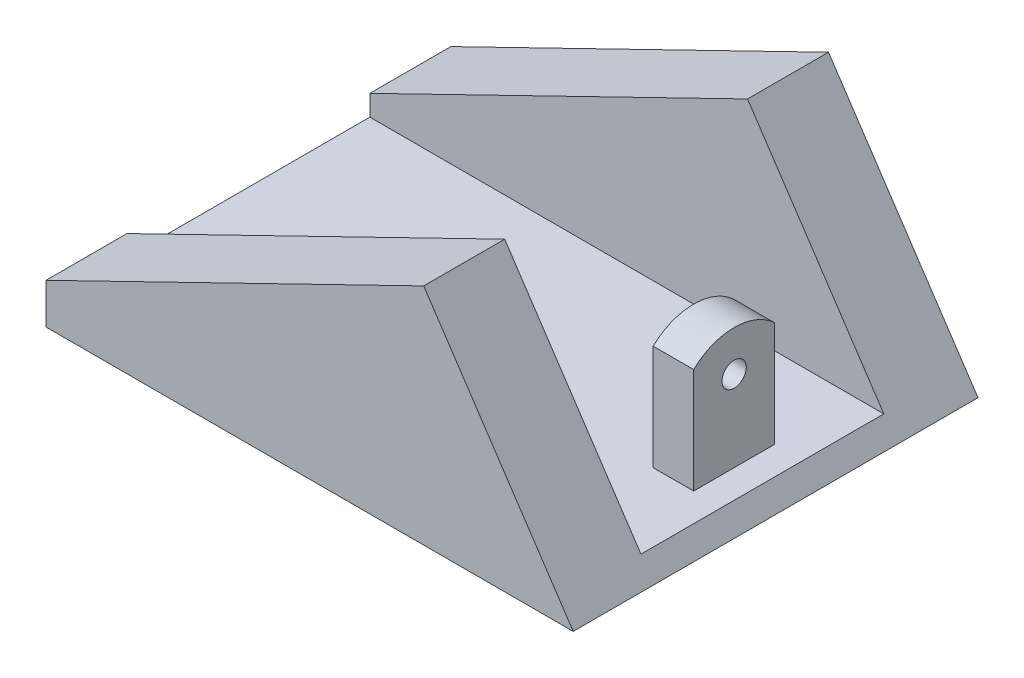
from build123d import *

# Parameters (mm, degrees)
SKETCH1_W           = 65.122
SKETCH1_H           = 27.725
BOSS_EXTRUDE1_DEPTH = 50
SKETCH3_W           = 65.122
SKETCH3_H           = 30
CUT_EXTRUDE1_DEPTH  = 25.272
CUT_EXTRUDE2_DEPTH  = 87.657662725
CUT_EXTRUDE3_DEPTH  = 87.657662725
SKETCH6_W           = 5
SKETCH6_H           = 10
BOSS_EXTRUDE2_DEPTH = 15
CUT_EXTRUDE5_DEPTH  = 15
SKETCH9_R           = 1.5
CUT_EXTRUDE6_DEPTH  = 83.877473568
SKETCH10_R          = 1.575
CUT_EXTRUDE7_DEPTH  = 86.904300637


with BuildPart() as part:
    # Sketch1 → Boss-Extrude1 (new body)
    with BuildSketch(Plane.XY):
        with Locations((32.561, 13.8625)):
            Rectangle(SKETCH1_W, SKETCH1_H)
    extrude(amount=BOSS_EXTRUDE1_DEPTH)

    # Sketch3 → Cut-Extrude1 (cut)
    with BuildSketch(Plane(origin=(0, 27.725, 0), x_dir=(1, 0, 0), z_dir=(0, 1, 0))):
        with Locations((32.561, -25)):
            Rectangle(SKETCH3_W, SKETCH3_H)
    extrude(amount=-CUT_EXTRUDE1_DEPTH, mode=Mode.SUBTRACT)

    # Sketch4 → Cut-Extrude2 (cut, through all)
    with BuildSketch(Plane.XY.offset(50)):
        Polygon((0, 27.725), (0, 5), (46.655, 27.725), align=None)
    extrude(amount=-CUT_EXTRUDE2_DEPTH, mode=Mode.SUBTRACT)

    # Sketch5 → Cut-Extrude3 (cut, through all)
    with BuildSketch(Plane.XY.offset(50)):
        Polygon((46.655, 27.725), (65.122, 0), (65.122, 27.725), align=None)
    extrude(amount=-CUT_EXTRUDE3_DEPTH, mode=Mode.SUBTRACT)

    # Sketch6 → Boss-Extrude2 (add)
    with BuildSketch(Plane(origin=(0, 2.453, 0), x_dir=(1, 0, 0), z_dir=(0, 1, 0))):
        with Locations((57.5, -25)):
            Rectangle(SKETCH6_W, SKETCH6_H)
    extrude(amount=BOSS_EXTRUDE2_DEPTH)

    # Sketch7 → Cut-Extrude5 (cut)
    with BuildSketch(Plane(origin=(60, 0, 0), x_dir=(0, 0, -1), z_dir=(1, 0, 0))):
        with BuildLine():
            Line((-30, 15.453), (-30, 17.453))
            Line((-30, 17.453), (-24.889040711, 17.831001858))
            Line((-24.889040711, 17.831001858), (-20, 17.453))
            Line((-20, 17.453), (-20, 15.453))
            ThreePointArc((-20, 15.453), (-25, 17.453), (-30, 15.453))
        make_face()
    extrude(amount=-CUT_EXTRUDE5_DEPTH, mode=Mode.SUBTRACT)

    # Sketch9 → Cut-Extrude6 (cut, through all)
    with BuildSketch(Plane(origin=(60, 0, 0), x_dir=(0, 0, -1), z_dir=(1, 0, 0))):
        with Locations((-25, 12.453)):
            Circle(SKETCH9_R)
    extrude(amount=-CUT_EXTRUDE6_DEPTH, mode=Mode.SUBTRACT)

    # Sketch10 → Cut-Extrude7 (cut, through all)
    with BuildSketch(Plane(origin=(0, 2.453, 0), x_dir=(1, 0, 0), z_dir=(0, 1, 0))):
        with Locations(Location((46.10608811, -35, 0), (0, 0, 270))):
            Circle(SKETCH10_R)
        with Locations(Location((46.10608811, -13, 0), (0, 0, 270))):
            Circle(SKETCH10_R)
    extrude(amount=-CUT_EXTRUDE7_DEPTH, mode=Mode.SUBTRACT)


solid = part.part
